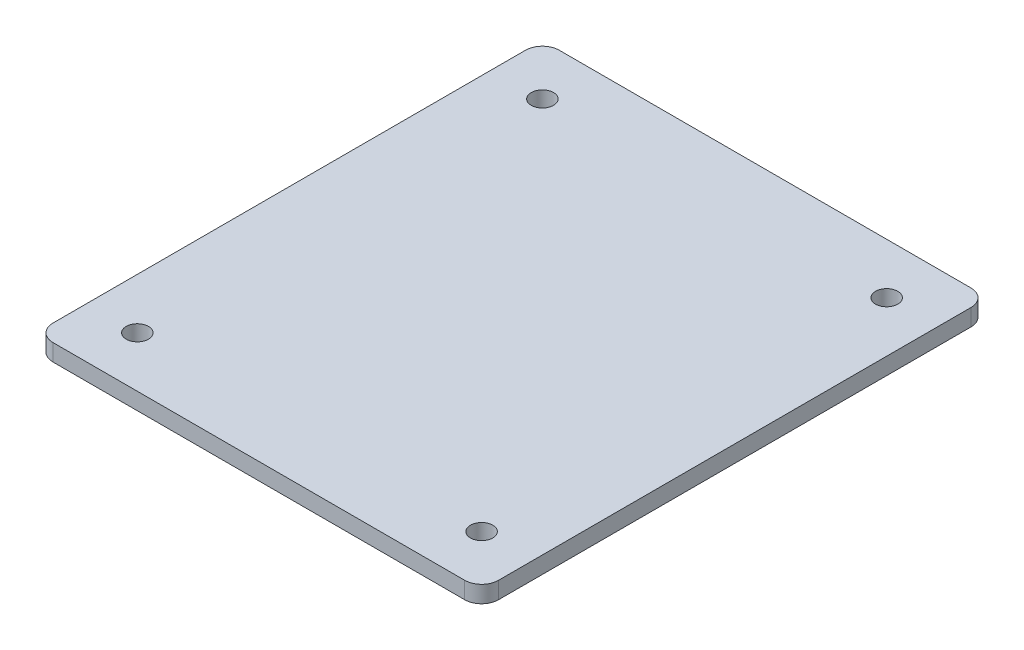
from build123d import *

# Parameters (mm, degrees)
SKETCH1_W                = 132
SKETCH1_H                = 150
BOSS_EXTRUDE1_DEPTH      = 5
M6_CLEARANCE_HOLE1_D     = 6.6
M6_CLEARANCE_HOLE1_DEPTH = 10
M6_CLEARANCE_HOLE1_TIP   = 1.982840043
FILLET1_R                = 5


with BuildPart() as part:
    # Sketch1 → Boss-Extrude1 (new body)
    with BuildSketch(Plane(origin=(0, 0, 0), x_dir=(1, 0, 0), z_dir=(0, 1, 0))):
        with Locations((66, 75)):
            Rectangle(SKETCH1_W, SKETCH1_H)
    extrude(amount=BOSS_EXTRUDE1_DEPTH)

    # M6 Clearance Hole1
    with Locations(Plane(origin=(0, 0, 0), x_dir=(-1, 0, 0), z_dir=(0, -1, 0))):
        with Locations((-15, 15), (-117, 15), (-117, 135), (-15, 135)):
            Hole(M6_CLEARANCE_HOLE1_D / 2, depth=M6_CLEARANCE_HOLE1_DEPTH)
            with Locations((0, 0, -(M6_CLEARANCE_HOLE1_DEPTH + M6_CLEARANCE_HOLE1_TIP / 2))):  # 118° drill point
                Cone(0, M6_CLEARANCE_HOLE1_D / 2, M6_CLEARANCE_HOLE1_TIP, mode=Mode.SUBTRACT)

    # Fillet1
    fillet1_edges = [part.edges().sort_by_distance(p)[0] for p in [
        (0, 2.5, -150),
        (132, 2.5, -150),
        (132, 2.5, 0),
        (0, 2.5, 0),
    ]]
    fillet(fillet1_edges, radius=FILLET1_R)


solid = part.part
